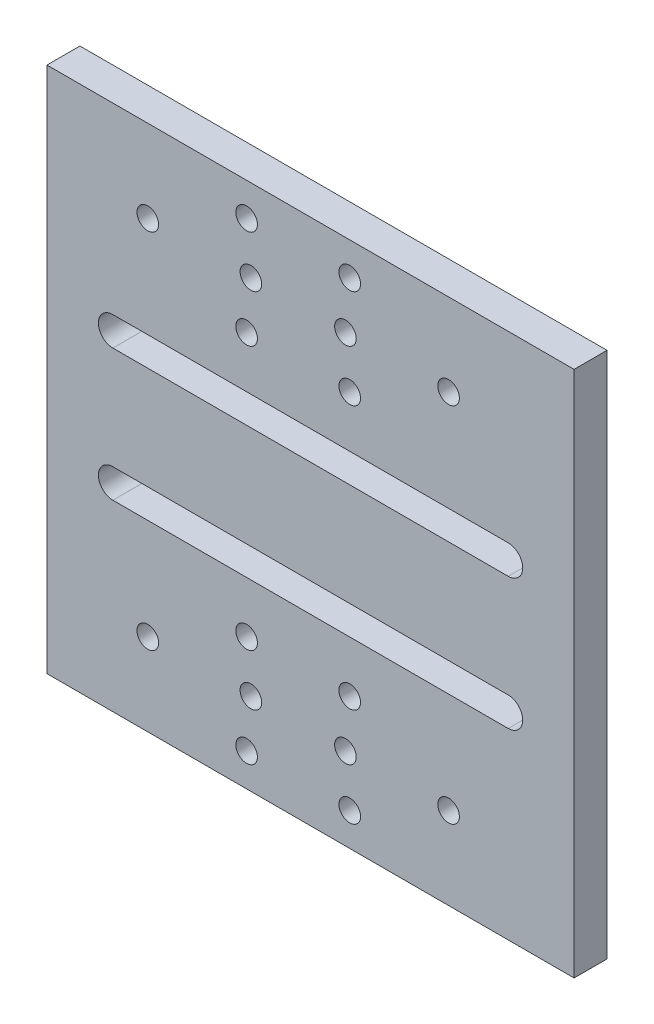
from build123d import *

# Parameters (mm, degrees)
SKETCH1_W               = 101.6
SKETCH1_H               = 6.35
BOSS_EXTRUDE1_DEPTH     = 101.6
CUT_EXTRUDE1_DEPTH      = 144.824345992
SKETCH5_R               = 2.0828
CUT_EXTRUDE2_DEPTH      = 144.824345992
MIRROR2_COPY_1_SKETCH_R = 2.0828
MIRROR2_COPY_1_DEPTH    = 144.824345992


with BuildPart() as part:
    # Sketch1 → Boss-Extrude1 (new body)
    with BuildSketch(Plane(origin=(0, 0, 0), x_dir=(1, 0, 0), z_dir=(0, 1, 0))):
        with Locations((50.8, 3.175)):
            Rectangle(SKETCH1_W, SKETCH1_H)
    extrude(amount=BOSS_EXTRUDE1_DEPTH)

    # Sketch2 → Cut-Extrude1 (cut, through all)
    with BuildSketch(Plane(origin=(0, 0, -6.35), x_dir=(-1, 0, 0), z_dir=(0, 0, -1))):
        with BuildLine():
            Line((-88.9, 66.294), (-12.7, 66.294))
            ThreePointArc((-12.7, 66.294), (-9.906, 63.5), (-12.7, 60.706))
            Line((-12.7, 60.706), (-88.9, 60.706))
            ThreePointArc((-88.9, 60.706), (-91.694, 63.5), (-88.9, 66.294))
        make_face()
        with BuildLine():
            Line((-88.9, 40.894), (-12.7, 40.894))
            ThreePointArc((-12.7, 40.894), (-9.906, 38.1), (-12.7, 35.306))
            Line((-12.7, 35.306), (-88.9, 35.306))
            ThreePointArc((-88.9, 35.306), (-91.694, 38.1), (-88.9, 40.894))
        make_face()
    extrude(amount=-CUT_EXTRUDE1_DEPTH, mode=Mode.SUBTRACT)

    # Sketch5 → Cut-Extrude2 (cut, through all)
    with BuildSketch(Plane.XY):
        with Locations((19.431, 85.725)):
            Circle(SKETCH5_R)
        with Locations((38.481, 95.25)):
            Circle(SKETCH5_R)
        with Locations((38.481, 76.2)):
            Circle(SKETCH5_R)
        with Locations((57.531, 85.725)):
            Circle(SKETCH5_R)
    cut_extrude2 = extrude(amount=-CUT_EXTRUDE2_DEPTH, mode=Mode.SUBTRACT)

    # Mirror1: Cut-Extrude2 across plane
    add(cut_extrude2.mirror(Plane.ZX.offset(50.8)), mode=Mode.SUBTRACT)

    # Mirror2: Cut-Extrude2 across plane
    add(cut_extrude2.mirror(Plane(origin=(48.41875, 0, 0), x_dir=(0, 0, 1), z_dir=(1, 0, 0))), mode=Mode.SUBTRACT)

    # Mirror2 copy 1 sketch → Mirror2 copy 1 (cut, through all)
    with BuildSketch(Plane(origin=(96.8375, 101.6, 0), x_dir=(-1, 0, 0), z_dir=(0, 0, 1))):
        with Locations((19.431, 85.725)):
            Circle(MIRROR2_COPY_1_SKETCH_R)
        with Locations((38.481, 95.25)):
            Circle(MIRROR2_COPY_1_SKETCH_R)
        with Locations((38.481, 76.2)):
            Circle(MIRROR2_COPY_1_SKETCH_R)
        with Locations((57.531, 85.725)):
            Circle(MIRROR2_COPY_1_SKETCH_R)
    extrude(amount=-MIRROR2_COPY_1_DEPTH, mode=Mode.SUBTRACT)


solid = part.part
